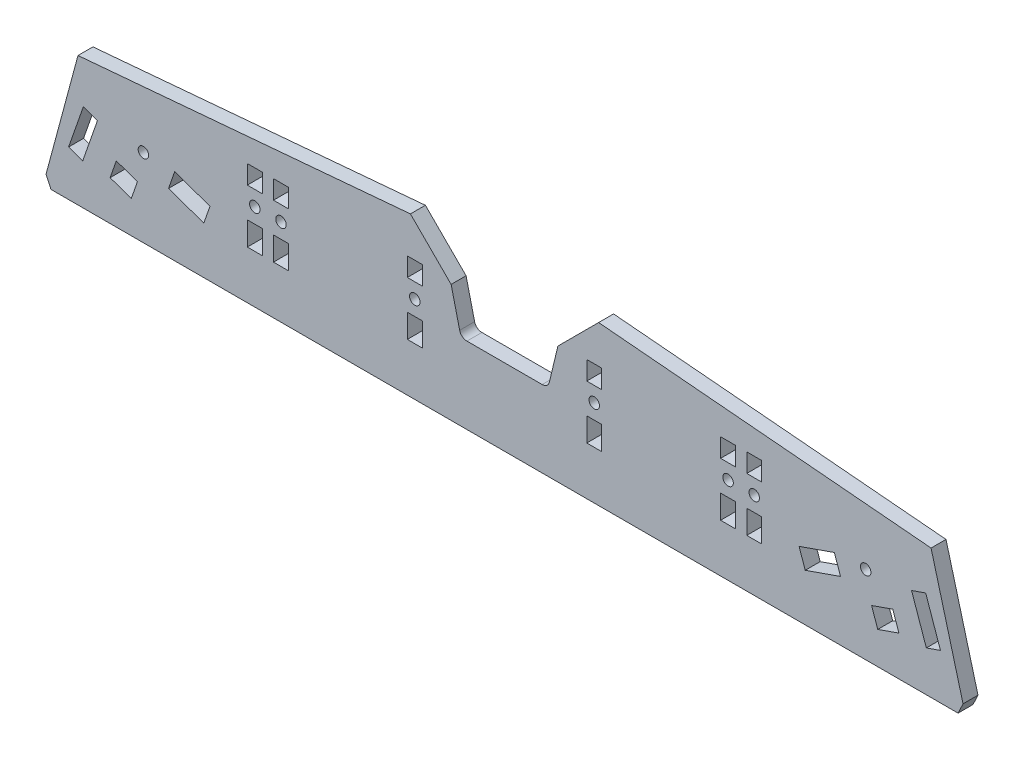
from build123d import *

# Parameters (mm, degrees)
SKETCH_1_W           = 220
SKETCH_1_H           = 35
EXTRUDE_1_DEPTH      = 4
CUT_EXTRUDE_1_DEPTH  = 10
CHAMFER_1_SIZE       = 5
EXTRUDE_2_DEPTH      = 4
EXTRUDE_3_DEPTH      = 4
EXTRUDE_4_DEPTH      = 4
EXTRUDE_7_DEPTH      = 4
FILLET_1_R           = 2
SKETCH_21_W          = 4
SKETCH_21_H          = 5
SKETCH_21_H_2        = 6.299038106
CUT_EXTRUDE_8_DEPTH  = 4
SKETCH_22_R          = 1.40240318
CUT_EXTRUDE_9_DEPTH  = 4
EXTRUDE_8_DEPTH      = 4
CUT_EXTRUDE_14_DEPTH = 10
CUT_EXTRUDE_15_DEPTH = 4
CHAMFER_2_SIZE       = 3
CHAMFER_2_SIZE2      = 2.344579619
SKETCH_29_W          = 6
SKETCH_29_H          = 5
SKETCH_29_W_2        = 10
SKETCH_29_W_3        = 4
SKETCH_29_H_2        = 12
CUT_EXTRUDE_16_DEPTH = 4
SKETCH_30_R          = 1.4
CUT_EXTRUDE_17_DEPTH = 4
EXTRUDE_9_DEPTH      = 4
SKETCH_35_R          = 44.644180149
CUT_EXTRUDE_19_DEPTH = 126.325939799
SKETCH_36_R          = 1.40240318
SKETCH_36_R_2        = 1.4
SKETCH_36_W          = 4
SKETCH_36_H          = 5
SKETCH_36_H_2        = 6.299038106
EXTRUDE_11_DEPTH     = 4


with BuildPart() as part:
    # 草图1 → 凸台-拉伸1 (new body)
    with BuildSketch(Plane.XY):
        Rectangle(SKETCH_1_W, SKETCH_1_H)
    extrude(amount=EXTRUDE_1_DEPTH)

    # 草图2 → 切除-拉伸1 (cut)
    with BuildSketch(Plane.XY.offset(4)):
        Polygon((0, 17.519994919), (-16.999988241, 17.5), (-16.999988241, 0), (17.000011759, 0), (17.000011759, 17.5), align=None)
    extrude(amount=-CUT_EXTRUDE_1_DEPTH, mode=Mode.SUBTRACT)

    # 倒角1
    chamfer_1_edges = [part.edges().sort_by_distance(p)[0] for p in [
        (17.000011759, 17.5, 2),
        (-16.999988241, 17.5, 2),
    ]]
    chamfer(chamfer_1_edges, length=CHAMFER_1_SIZE)

    # 草图3 → 凸台-拉伸2 (add)
    with BuildSketch(Plane(origin=(0, 0, 0), x_dir=(-1, 0, 0), z_dir=(0, 0, -1))):
        Polygon((-17.000011759, 0), (-17.000011759, 12.5), (-14.000011759, 0), align=None)
        Polygon((16.999988241, 12.5), (16.999988241, 0), (13.999988241, 0), align=None)
    extrude(amount=-EXTRUDE_2_DEPTH)

    # 草图4 → 凸台-拉伸3 (add)
    with BuildSketch(Plane(origin=(0, 0, 0), x_dir=(-1, 0, 0), z_dir=(0, 0, -1))):
        Polygon((-22.000011759, 17.5), (-29.071079571, 24.571067812), (-110, 17.5), align=None)
        Polygon((21.999988241, 17.5), (29.071056053, 24.571067812), (110, 17.5), align=None)
    extrude(amount=-EXTRUDE_3_DEPTH)

    # 草图7 → 凸台-拉伸4 (add)
    with BuildSketch(Plane(origin=(0, 0, 0), x_dir=(-1, 0, 0), z_dir=(0, 0, -1))):
        Polygon((-110, 17.5), (-115.977227757, 16.97774686), (-112.5, -17.5), (-110, -17.5), align=None)
    extrude_4 = extrude(amount=-EXTRUDE_4_DEPTH)

    # 草图19 → 凸台-拉伸7 (add)
    with BuildSketch(Plane(origin=(0, 0, 0), x_dir=(-1, 0, 0), z_dir=(0, 0, -1))):
        Polygon((-17.000011759, 12.5), (-29.071079571, 24.571067812), (-25.649595146, 25.392224074), (-14.280331934, 14.022960862), (-11.634821327, 3), (11.63479781, 3), (14.280308417, 14.022960862), (25.169324411, 24.911976857), (29.071056053, 24.571067812), (16.999988241, 12.5), (13.999988241, 0), (-14.000011759, 0), align=None)
    extrude(amount=-EXTRUDE_7_DEPTH)

    # 圆角1
    fillet_1_edges = [part.edges().sort_by_distance(p)[0] for p in [
        (-11.63479781, 3, 2),
        (11.634821327, 3, 2),
    ]]
    fillet(fillet_1_edges, radius=FILLET_1_R)

    # 草图21 → 切除-拉伸8 (cut)
    with BuildSketch(Plane(origin=(133.943153128, -40.880278438, 0), x_dir=(1, 0, 0), z_dir=(0, 0, -1))):
        with Locations((-67.143153128, -53.147127978)):
            Rectangle(SKETCH_21_W, SKETCH_21_H)
        with Locations((-74.143153128, -53.147127978)):
            Rectangle(SKETCH_21_W, SKETCH_21_H)
        with Locations((-67.143153128, -39.44868951)):
            Rectangle(SKETCH_21_W, SKETCH_21_H_2)
        with Locations((-74.143153128, -39.44868951)):
            Rectangle(SKETCH_21_W, SKETCH_21_H_2)
        with Locations((-109.943153128, -53.147127978)):
            Rectangle(SKETCH_21_W, SKETCH_21_H)
        with Locations((-109.943153128, -39.44868951)):
            Rectangle(SKETCH_21_W, SKETCH_21_H_2)
        with Locations((-157.943153128, -39.44868951)):
            Rectangle(SKETCH_21_W, SKETCH_21_H_2)
        with Locations((-157.943153128, -53.147127978)):
            Rectangle(SKETCH_21_W, SKETCH_21_H)
        with Locations((-200.743153128, -39.44868951)):
            Rectangle(SKETCH_21_W, SKETCH_21_H_2)
        with Locations((-193.743153128, -39.44868951)):
            Rectangle(SKETCH_21_W, SKETCH_21_H_2)
        with Locations((-193.743153128, -53.147127978)):
            Rectangle(SKETCH_21_W, SKETCH_21_H)
        with Locations((-200.743153128, -53.147127978)):
            Rectangle(SKETCH_21_W, SKETCH_21_H)
    extrude(amount=-CUT_EXTRUDE_8_DEPTH, mode=Mode.SUBTRACT)

    # 草图22 → 切除-拉伸9 (cut)
    with BuildSketch(Plane(origin=(133.943153128, -40.880278438, 0), x_dir=(1, 0, 0), z_dir=(0, 0, -1))):
        with Locations(Location((-109.943153128, -46.620265091, 0), (0, 0, 180))):
            Circle(SKETCH_22_R)
        with Locations(Location((-74.143153128, -46.620265091, 0), (0, 0, 180))):
            Circle(SKETCH_22_R)
        with Locations(Location((-67.143153128, -46.620265091, 0), (0, 0, 180))):
            Circle(SKETCH_22_R)
    cut_extrude_9 = extrude(amount=-CUT_EXTRUDE_9_DEPTH, mode=Mode.SUBTRACT)

    # 镜向10: 切除-拉伸9 across plane
    add(cut_extrude_9.mirror(Plane(origin=(0, 0, 0), x_dir=(0, 0, 1), z_dir=(1, 0, 0))), mode=Mode.SUBTRACT)

    # 镜向11: 凸台-拉伸4 across plane
    add(extrude_4.mirror(Plane(origin=(0, 0, 0), x_dir=(0, 0, 1), z_dir=(1, 0, 0))))

    # 草图23 → 凸台-拉伸8 (add)
    with BuildSketch(Plane(origin=(0, 0, 0), x_dir=(-1, 0, 0), z_dir=(0, 0, -1))):
        Polygon((115.977227757, 16.97774686), (112.5, -17.5), (123.677307019, -17.5), (127.041988649, 15.861818553), align=None)
    extrude(amount=-EXTRUDE_8_DEPTH)

    # 草图27 → 切除-拉伸14 (cut)
    with BuildSketch(Plane(origin=(0, 0, 0), x_dir=(-1, 0, 0), z_dir=(0, 0, -1))):
        Polygon((123.677307019, -17.5), (127.041988649, 15.861818553), (110.453235561, 19.244980627), (111.116335779, 17.402461494), align=None)
    extrude(amount=-CUT_EXTRUDE_14_DEPTH, mode=Mode.SUBTRACT)

    # 草图28 → 切除-拉伸15 (cut)
    with BuildSketch(Plane(origin=(133.943153128, -40.880278438, 0), x_dir=(1, 0, 0), z_dir=(0, 0, -1))):
        Polygon((-214.384814898, -36.029379852), (-223.826225744, -39.324795038), (-222.178518151, -44.04550046), (-212.737107305, -40.750085275), align=None)
        Polygon((-239.450613316, -34.009451966), (-237.802905723, -38.730157389), (-232.138059216, -36.752908277), (-233.785766808, -32.032202855), align=None)
        Polygon((-242.830523796, -45.567593925), (-246.785022019, -34.23790091), (-250.561586358, -35.556066985), (-246.607088135, -46.885759999), align=None)
    extrude(amount=-CUT_EXTRUDE_15_DEPTH, mode=Mode.SUBTRACT)

    # 倒角2
    chamfer_2_edges = [part.edges().sort_by_distance(p)[0] for p in [
        (-123.677307019, -17.5, 2),
    ]]
    chamfer_2_side = [part.faces().sort_by_distance(p)[0] for p in [
        (-117.396821399, -0.048769253, 2),
    ]]
    chamfer(chamfer_2_edges, length=CHAMFER_2_SIZE, length2=CHAMFER_2_SIZE2, reference=chamfer_2_side[0])

    # 草图29 → 切除-拉伸16 (cut)
    with BuildSketch(Plane(origin=(133.943153128, -40.880278438, 0), x_dir=(1, 0, 0), z_dir=(0, 0, -1))):
        with Locations((-37.943153128, -39.581582586)):
            Rectangle(SKETCH_29_W, SKETCH_29_H)
        with Locations((-52.943153128, -49.748900766)):
            Rectangle(SKETCH_29_W_2, SKETCH_29_H)
        with Locations((-25.943153128, -40.880278438)):
            Rectangle(SKETCH_29_W_3, SKETCH_29_H_2)
    extrude(amount=-CUT_EXTRUDE_16_DEPTH, mode=Mode.SUBTRACT)

    # 草图30 → 切除-拉伸17 (cut)
    with BuildSketch(Plane(origin=(133.943153128, -40.880278438, 0), x_dir=(1, 0, 0), z_dir=(0, 0, -1))):
        with Locations(Location((-39.943153128, -49.748900766, 0), (0, 0, 180))):
            Circle(SKETCH_30_R)
        with Locations(Location((-230.555500624, -44.321479898, 0), (0, 0, 180))):
            Circle(SKETCH_30_R)
    extrude(amount=-CUT_EXTRUDE_17_DEPTH, mode=Mode.SUBTRACT)

    # 草图31 → 凸台-拉伸9 (add)
    with BuildSketch(Plane(origin=(0, 0, 0), x_dir=(-1, 0, 0), z_dir=(0, 0, -1))):
        Polygon((111.116335769, 17.402461523), (114.104949654, 17.141335029), (122.661428914, -14.677236872), align=None)
    extrude(amount=-EXTRUDE_9_DEPTH)

    # 草图35 → 切除-拉伸19 (cut, through all)
    with BuildSketch(Plane(origin=(0, 0, 0), x_dir=(0, 0, -1), z_dir=(1, 0, 0))):
        Circle(SKETCH_35_R)
    extrude(amount=CUT_EXTRUDE_19_DEPTH, mode=Mode.SUBTRACT)

    # 草图36 → 凸台-拉伸11 (add)
    with BuildSketch(Plane(origin=(0, 0, 0), x_dir=(-1, 0, 0), z_dir=(0, 0, -1))):
        with BuildLine():
            Line((-121.3327274, -17.5), (121.3327274, -17.5))
            Line((121.3327274, -17.5), (122.661428914, -14.677236872))
            Line((122.661428914, -14.677236872), (114.104949654, 17.141335029))
            Line((114.104949654, 17.141335029), (110, 17.5))
            Line((110, 17.5), (25.169324411, 24.911976857))
            Line((25.169324411, 24.911976857), (14.280308417, 14.022960862))
            Line((14.280308417, 14.022960862), (12.002778792, 4.533254095))
            ThreePointArc((12.002778792, 4.533254095), (11.296250567, 3.429412242), (10.058004188, 3))
            Line((10.058004188, 3), (-10.058004188, 3))
            ThreePointArc((-10.058004188, 3), (-11.296250567, 3.429412242), (-12.002778792, 4.533254095))
            Line((-12.002778792, 4.533254095), (-14.280308417, 14.022960862))
            Line((-14.280308417, 14.022960862), (-25.169324411, 24.911976857))
            Line((-25.169324411, 24.911976857), (-110, 17.5))
            Line((-110, 17.5), (-114.104949654, 17.141335029))
            Line((-114.104949654, 17.141335029), (-122.661428914, -14.677236872))
            Line((-122.661428914, -14.677236872), (-121.3327274, -17.5))
        make_face()
        with Locations(Location((24, 5.739986652, 0), (0, 0, 180))):
            Circle(SKETCH_36_R, mode=Mode.SUBTRACT)
        with Locations(Location((59.8, 5.739986652, 0), (0, 0, 180))):
            Circle(SKETCH_36_R, mode=Mode.SUBTRACT)
        with Locations(Location((66.8, 5.739986652, 0), (0, 0, 180))):
            Circle(SKETCH_36_R, mode=Mode.SUBTRACT)
        with Locations((96.612347495, 3.44120146)):
            Circle(SKETCH_36_R_2, mode=Mode.SUBTRACT)
        with Locations(Location((-96.612347495, 3.44120146, 0), (0, 0, 180))):
            Circle(SKETCH_36_R_2, mode=Mode.SUBTRACT)
        with Locations(Location((-66.8, 5.739986652, 0), (0, 0, 180))):
            Circle(SKETCH_36_R, mode=Mode.SUBTRACT)
        with Locations(Location((-59.8, 5.739986652, 0), (0, 0, 180))):
            Circle(SKETCH_36_R, mode=Mode.SUBTRACT)
        with Locations(Location((-24, 5.739986652, 0), (0, 0, 180))):
            Circle(SKETCH_36_R, mode=Mode.SUBTRACT)
        with Locations((24, 12.26684954)):
            Rectangle(SKETCH_36_W, SKETCH_36_H, mode=Mode.SUBTRACT)
        with Locations((24, -1.431588928)):
            Rectangle(SKETCH_36_W, SKETCH_36_H_2, mode=Mode.SUBTRACT)
        Polygon((80.44166177, -4.850898586), (89.883072616, -1.5554834), (88.235365023, 3.165222022), (78.793954177, -0.130193163), align=None, mode=Mode.SUBTRACT)
        with Locations((59.8, -1.431588928)):
            Rectangle(SKETCH_36_W, SKETCH_36_H_2, mode=Mode.SUBTRACT)
        with Locations((59.8, 12.26684954)):
            Rectangle(SKETCH_36_W, SKETCH_36_H, mode=Mode.SUBTRACT)
        with Locations((66.8, 12.26684954)):
            Rectangle(SKETCH_36_W, SKETCH_36_H, mode=Mode.SUBTRACT)
        Polygon((112.841868891, -6.642377528), (116.618433229, -5.324211453), (112.663935006, 6.005481561), (108.887370668, 4.687315487), align=None, mode=Mode.SUBTRACT)
        Polygon((105.507460187, -6.870826472), (103.859752595, -2.150121049), (98.194906087, -4.127370161), (99.84261368, -8.848075584), align=None, mode=Mode.SUBTRACT)
        with Locations((66.8, -1.431588928)):
            Rectangle(SKETCH_36_W, SKETCH_36_H_2, mode=Mode.SUBTRACT)
        with Locations((-66.8, 12.26684954)):
            Rectangle(SKETCH_36_W, SKETCH_36_H, mode=Mode.SUBTRACT)
        with Locations((-66.8, -1.431588928)):
            Rectangle(SKETCH_36_W, SKETCH_36_H_2, mode=Mode.SUBTRACT)
        Polygon((-98.194906087, -4.127370161), (-99.84261368, -8.848075584), (-105.507460187, -6.870826472), (-103.859752595, -2.150121049), align=None, mode=Mode.SUBTRACT)
        Polygon((-108.887370668, 4.687315487), (-112.841868891, -6.642377528), (-116.618433229, -5.324211453), (-112.663935006, 6.005481561), align=None, mode=Mode.SUBTRACT)
        with Locations((-59.8, 12.26684954)):
            Rectangle(SKETCH_36_W, SKETCH_36_H, mode=Mode.SUBTRACT)
        with Locations((-59.8, -1.431588928)):
            Rectangle(SKETCH_36_W, SKETCH_36_H_2, mode=Mode.SUBTRACT)
        Polygon((-89.883072616, -1.5554834), (-88.235365023, 3.165222022), (-78.793954177, -0.130193163), (-80.44166177, -4.850898586), align=None, mode=Mode.SUBTRACT)
        with Locations((-24, -1.431588928)):
            Rectangle(SKETCH_36_W, SKETCH_36_H_2, mode=Mode.SUBTRACT)
        with Locations((-24, 12.26684954)):
            Rectangle(SKETCH_36_W, SKETCH_36_H, mode=Mode.SUBTRACT)
    extrude(amount=-EXTRUDE_11_DEPTH)


solid = part.part
